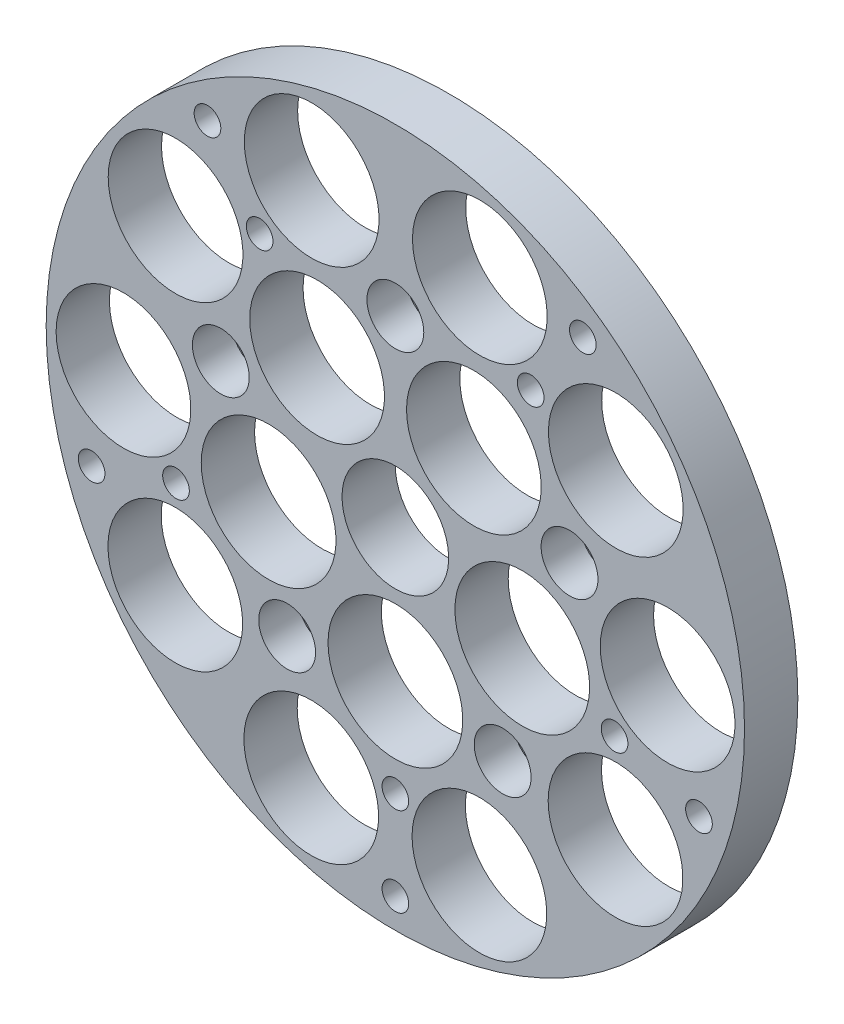
from build123d import *
from OCP.BRepFilletAPI import BRepFilletAPI_MakeChamfer

# Parameters (mm, degrees)
SKETCH2_R           = 49.911
SKETCH2_R_2         = 7.62
SKETCH2_R_3         = 9.6266
BOSS_EXTRUDE3_DEPTH = 7.62
SKETCH4_R           = 4.064
CUT_EXTRUDE1_DEPTH  = 71.994931101
SKETCH5_R           = 1.905
SKETCH5_R_2         = 9.6266
CUT_EXTRUDE2_DEPTH  = 71.994931101
CHAMFER1_SIZE       = 2.032
CHAMFER1_SIZE2      = 1.422821718


with BuildPart() as part:
    # Sketch2 → Boss-Extrude3 (new body)
    with BuildSketch(Plane.XY):
        with Locations(Location((0, 0, 0), (0, 0, 180))):
            Circle(SKETCH2_R)
        with Locations(Location((0, 0, 0), (0, 0, 180))):
            Circle(SKETCH2_R_2, mode=Mode.SUBTRACT)
        with Locations(Location((0.005302646, -19.066344944, 0), (0, 0, 180))):
            Circle(SKETCH2_R_3, mode=Mode.SUBTRACT)
        with Locations(Location((18.140112855, -5.903126437, 0), (0, 0, 180))):
            Circle(SKETCH2_R_3, mode=Mode.SUBTRACT)
        with Locations(Location((11.225112662, 15.411761203, 0), (0, 0, 180))):
            Circle(SKETCH2_R_3, mode=Mode.SUBTRACT)
        with Locations(Location((-11.183402698, 15.421867724, 0), (0, 0, 180))):
            Circle(SKETCH2_R_3, mode=Mode.SUBTRACT)
        with Locations(Location((-18.117626635, -5.886773743, 0), (0, 0, 180))):
            Circle(SKETCH2_R_3, mode=Mode.SUBTRACT)
        with Locations(Location((-38.862, 0, 0), (0, 0, 180))):
            Circle(SKETCH2_R_3, mode=Mode.SUBTRACT)
        with Locations(Location((-31.453761301, -22.864504732, 0), (0, 0, 180))):
            Circle(SKETCH2_R_3, mode=Mode.SUBTRACT)
        with Locations(Location((-12.020951612, -37.007824175, 0), (0, 0, 180))):
            Circle(SKETCH2_R_3, mode=Mode.SUBTRACT)
        with Locations(Location((12.013756262, -37.027691016, 0), (0, 0, 180))):
            Circle(SKETCH2_R_3, mode=Mode.SUBTRACT)
        with Locations(Location((31.469920822, -22.916516796, 0), (0, 0, 180))):
            Circle(SKETCH2_R_3, mode=Mode.SUBTRACT)
        with Locations(Location((38.915948498, -0.064290447, 0), (0, 0, 180))):
            Circle(SKETCH2_R_3, mode=Mode.SUBTRACT)
        with Locations(Location((31.507709799, 22.800214285, 0), (0, 0, 180))):
            Circle(SKETCH2_R_3, mode=Mode.SUBTRACT)
        with Locations(Location((12.07490011, 36.943533728, 0), (0, 0, 180))):
            Circle(SKETCH2_R_3, mode=Mode.SUBTRACT)
        with Locations(Location((-11.959807763, 36.963400568, 0), (0, 0, 180))):
            Circle(SKETCH2_R_3, mode=Mode.SUBTRACT)
        with Locations(Location((-31.415972324, 22.852226349, 0), (0, 0, 180))):
            Circle(SKETCH2_R_3, mode=Mode.SUBTRACT)
    extrude(amount=BOSS_EXTRUDE3_DEPTH)

    # Sketch4 → Cut-Extrude1 (cut, through all)
    with BuildSketch(Plane.XY.offset(7.62)):
        with Locations((0, 26.17695394)):
            Circle(SKETCH4_R)
        with Locations((24.895762621, 8.037987129)):
            Circle(SKETCH4_R)
        with Locations((15.337793775, -21.244539145)):
            Circle(SKETCH4_R)
        with Locations((-15.465118457, -21.203168848)):
            Circle(SKETCH4_R)
        with Locations((-24.944396322, 8.104925676)):
            Circle(SKETCH4_R)
    extrude(amount=-CUT_EXTRUDE1_DEPTH, mode=Mode.SUBTRACT)

    # Sketch5 → Cut-Extrude2 (cut, through all)
    with BuildSketch(Plane(origin=(0, 0, 0), x_dir=(-1, 0, 0), z_dir=(0, 0, -1))):
        with Locations((-0.00287222, -45.643800189)):
            Circle(SKETCH5_R)
        with Locations((-0.00287222, -32.960144289)):
            Circle(SKETCH5_R)
        with Locations((12.020951612, -37.007824175)):
            Circle(SKETCH5_R_2)
        with Locations((-43.398142788, -14.092845642)):
            Circle(SKETCH5_R)
        with Locations((-31.335269193, -10.173380418)):
            Circle(SKETCH5_R)
        with Locations((-26.801277951, 36.928290351)):
            Circle(SKETCH5_R)
        with Locations((-19.346012068, 26.666997177)):
            Circle(SKETCH5_R)
        with Locations((26.851419192, 36.910131993)):
            Circle(SKETCH5_R)
        with Locations((19.396153308, 26.648838818)):
            Circle(SKETCH5_R)
        with Locations((43.413744778, -14.122226483)):
            Circle(SKETCH5_R)
        with Locations((31.350871183, -10.20276126)):
            Circle(SKETCH5_R)
    extrude(amount=-CUT_EXTRUDE2_DEPTH, mode=Mode.SUBTRACT)

    # Chamfer1: one chamfer whose edges measure the first distance from different faces: ONE call of the kernel's chamfer builder (chamfer() names one face for all edges)
    chamfer1_edges_1 = [part.edges().sort_by_distance(p)[0] for p in [
        (-4.064, 26.17695394, 0),
    ]]
    chamfer1_side_1 = [part.faces().sort_by_distance(p)[0] for p in [
        (-4.064, 26.17695394, 3.81),
    ]]
    chamfer1_edges_2 = [part.edges().sort_by_distance(p)[0] for p in [
        (20.831762621, 8.037987129, 0),
    ]]
    chamfer1_side_2 = [part.faces().sort_by_distance(p)[0] for p in [
        (20.831762621, 8.037987129, 3.81),
    ]]
    chamfer1_edges_3 = [part.edges().sort_by_distance(p)[0] for p in [
        (11.273793775, -21.244539145, 0),
    ]]
    chamfer1_side_3 = [part.faces().sort_by_distance(p)[0] for p in [
        (11.273793775, -21.244539145, 3.81),
    ]]
    chamfer1_edges_4 = [part.edges().sort_by_distance(p)[0] for p in [
        (-19.529118457, -21.203168848, 0),
    ]]
    chamfer1_side_4 = [part.faces().sort_by_distance(p)[0] for p in [
        (-19.529118457, -21.203168848, 3.81),
    ]]
    chamfer1_edges_5 = [part.edges().sort_by_distance(p)[0] for p in [
        (-29.008396322, 8.104925676, 0),
    ]]
    chamfer1_side_5 = [part.faces().sort_by_distance(p)[0] for p in [
        (-29.008396322, 8.104925676, 3.81),
    ]]
    chamfer1 = BRepFilletAPI_MakeChamfer(part.part.solid().wrapped)
    for e in chamfer1_edges_1:
        chamfer1.Add(CHAMFER1_SIZE, CHAMFER1_SIZE2, e.wrapped, chamfer1_side_1[0].wrapped)  # the first distance lies on this face
    for e in chamfer1_edges_2:
        chamfer1.Add(CHAMFER1_SIZE, CHAMFER1_SIZE2, e.wrapped, chamfer1_side_2[0].wrapped)  # the first distance lies on this face
    for e in chamfer1_edges_3:
        chamfer1.Add(CHAMFER1_SIZE, CHAMFER1_SIZE2, e.wrapped, chamfer1_side_3[0].wrapped)  # the first distance lies on this face
    for e in chamfer1_edges_4:
        chamfer1.Add(CHAMFER1_SIZE, CHAMFER1_SIZE2, e.wrapped, chamfer1_side_4[0].wrapped)  # the first distance lies on this face
    for e in chamfer1_edges_5:
        chamfer1.Add(CHAMFER1_SIZE, CHAMFER1_SIZE2, e.wrapped, chamfer1_side_5[0].wrapped)  # the first distance lies on this face
    add(Compound.cast(chamfer1.Shape()), mode=Mode.REPLACE)


solid = part.part
